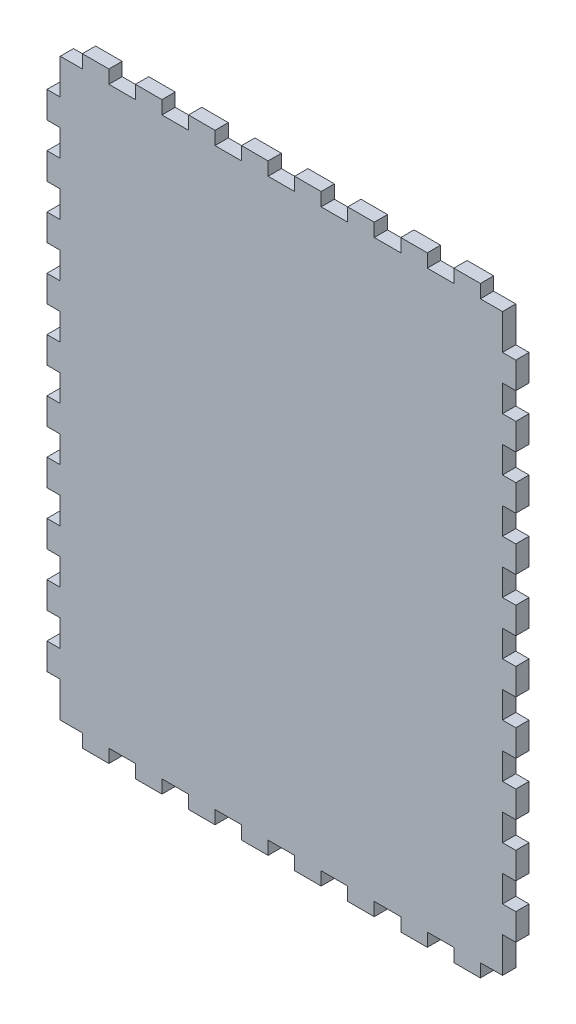
from build123d import *

# Parameters (mm, degrees)
BOSS_EXTRUDE1_DEPTH = 6


with BuildPart() as part:
    # Model → Boss-Extrude1 (new body)
    with BuildSketch(Plane.XY):
        Polygon((496, 269), (496, 253), (490, 253), (490, 241), (496, 241), (496, 229), (490, 229), (490, 217), (496, 217), (496, 205), (490, 205), (490, 193), (496, 193), (496, 181), (490, 181), (490, 169), (496, 169), (496, 157), (490, 157), (490, 145), (496, 145), (496, 133), (490, 133), (490, 121), (496, 121), (496, 109), (490, 109), (490, 97), (496, 97), (496, 85), (490, 85), (490, 73), (496, 73), (496, 61), (490, 61), (490, 49), (496, 49), (496, 37), (490, 37), (490, 25), (496, 25), (496, 13), (496, 9), (506, 9), (506, 3), (518, 3), (518, 9), (530, 9), (530, 3), (542, 3), (542, 9), (554, 9), (554, 3), (566, 3), (566, 9), (578, 9), (578, 3), (590, 3), (590, 9), (602, 9), (602, 3), (614, 3), (614, 9), (626, 9), (626, 3), (638, 3), (638, 9), (650, 9), (650, 3), (662, 3), (662, 9), (674, 9), (674, 3), (686, 3), (686, 9), (696, 9), (696, 25), (702, 25), (702, 37), (696, 37), (696, 49), (702, 49), (702, 61), (696, 61), (696, 73), (702, 73), (702, 85), (696, 85), (696, 97), (702, 97), (702, 109), (696, 109), (696, 121), (702, 121), (702, 133), (696, 133), (696, 145), (702, 145), (702, 157), (696, 157), (696, 169), (702, 169), (702, 181), (696, 181), (696, 193), (702, 193), (702, 205), (696, 205), (696, 217), (702, 217), (702, 229), (696, 229), (696, 241), (702, 241), (702, 253), (696, 253), (696, 265), (696, 269), (686, 269), (686, 275), (674, 275), (674, 269), (662, 269), (662, 275), (650, 275), (650, 269), (638, 269), (638, 275), (626, 275), (626, 269), (614, 269), (614, 275), (602, 275), (602, 269), (590, 269), (590, 275), (578, 275), (578, 269), (566, 269), (566, 275), (554, 275), (554, 269), (542, 269), (542, 275), (530, 275), (530, 269), (518, 269), (518, 275), (506, 275), (506, 269), align=None)
    extrude(amount=BOSS_EXTRUDE1_DEPTH)


solid = part.part
